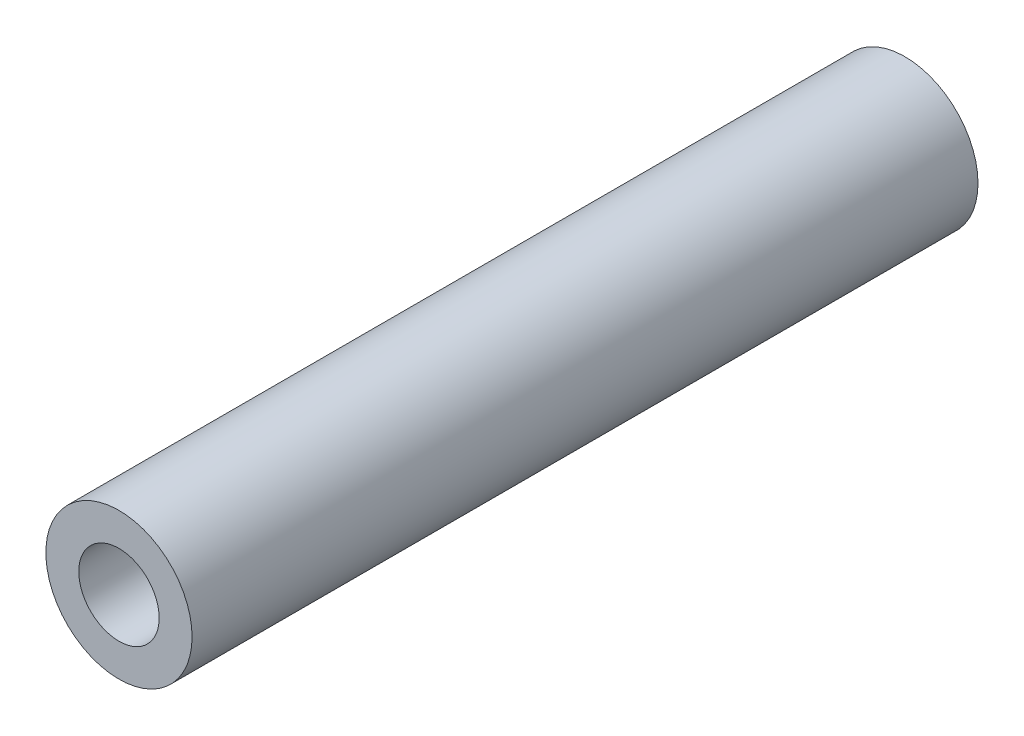
from build123d import *

# Parameters (mm, degrees)
M4_CLEARANCE_PROFILE_R   = 4
M4_CLEARANCE_PROFILE_R_2 = 2.2
M4_CLEARANCE_DEPTH       = 43


with BuildPart() as part:
    # M4 clearance profile → M4 clearance (new body)
    with BuildSketch(Plane.XY):
        Circle(M4_CLEARANCE_PROFILE_R)
        Circle(M4_CLEARANCE_PROFILE_R_2, mode=Mode.SUBTRACT)
    extrude(amount=M4_CLEARANCE_DEPTH)


solid = part.part
